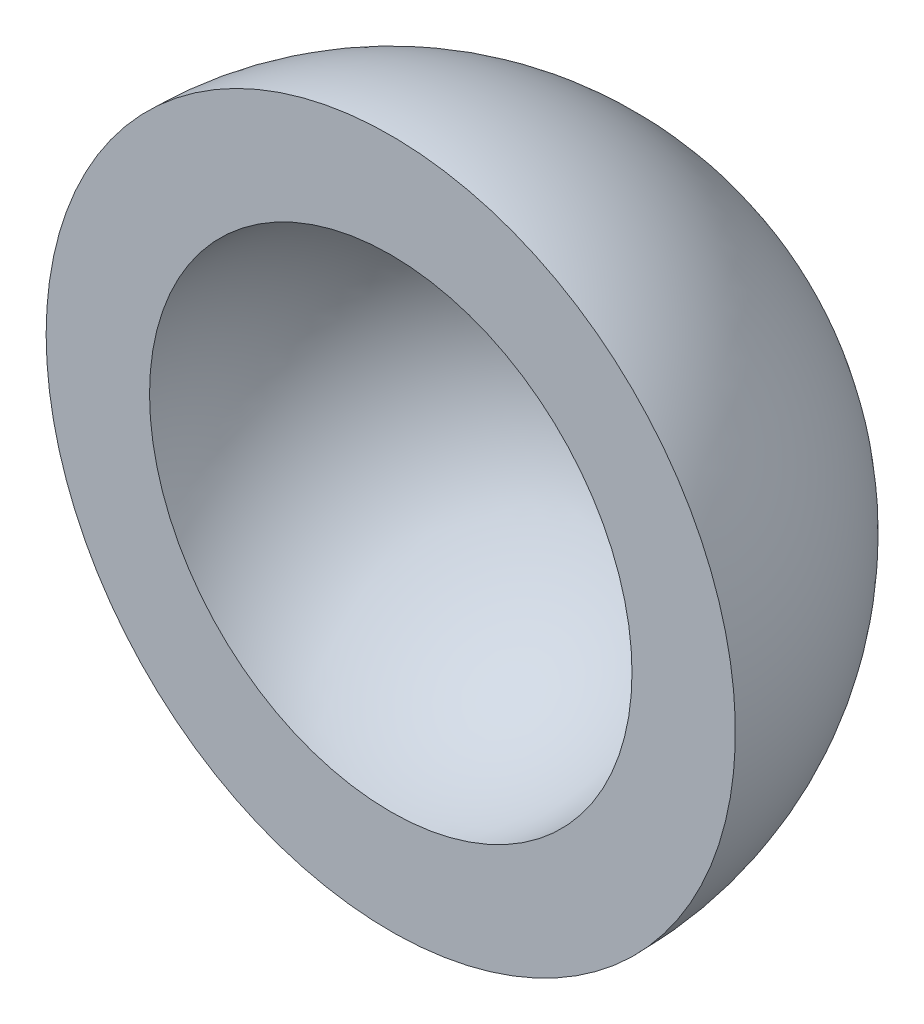
from build123d import *

# Parameters (mm, degrees)
REVOLVE_1_ANGLE = 180


with BuildPart() as part:
    # ｽｹｯﾁ1 → 回転1 (revolve)
    with BuildSketch(Plane.XY):
        with BuildLine():
            Line((0, 70), (0, 100))
            ThreePointArc((0, 100), (-100, 0), (0, -100))
            Line((0, -100), (0, -70))
            ThreePointArc((0, -70), (-70, 0), (0, 70))
        make_face()
    revolve(axis=Axis((0, 100, 0), (0, -1, 0)), revolution_arc=REVOLVE_1_ANGLE)


solid = part.part
